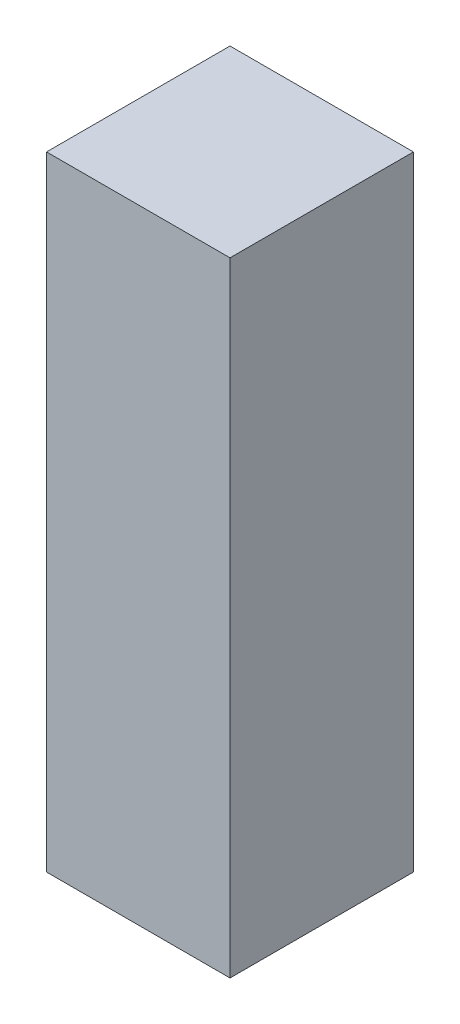
from build123d import *

# Parameters (mm, degrees)
SKETCH1_W           = 30
SKETCH1_H           = 30
SKETCH1_W_2         = 26
SKETCH1_H_2         = 26
BOSS_EXTRUDE1_DEPTH = 100
SKETCH2_W           = 30
SKETCH2_H           = 30
BOSS_EXTRUDE2_DEPTH = 1
SKETCH3_W           = 30
SKETCH3_H           = 30
BOSS_EXTRUDE3_DEPTH = 1


with BuildPart() as part:
    # Sketch1 → Boss-Extrude1 (new body)
    with BuildSketch(Plane(origin=(0, 0, 0), x_dir=(1, 0, 0), z_dir=(0, 1, 0))):
        Rectangle(SKETCH1_W, SKETCH1_H)
        Rectangle(SKETCH1_W_2, SKETCH1_H_2, mode=Mode.SUBTRACT)
    extrude(amount=BOSS_EXTRUDE1_DEPTH)

    # Sketch2 → Boss-Extrude2 (add)
    with BuildSketch(Plane(origin=(0, 100, 0), x_dir=(1, 0, 0), z_dir=(0, 1, 0))):
        Rectangle(SKETCH2_W, SKETCH2_H)
    extrude(amount=BOSS_EXTRUDE2_DEPTH)

    # Sketch3 → Boss-Extrude3 (add)
    with BuildSketch(Plane.XZ):
        Rectangle(SKETCH3_W, SKETCH3_H)
    extrude(amount=BOSS_EXTRUDE3_DEPTH)


solid = part.part
